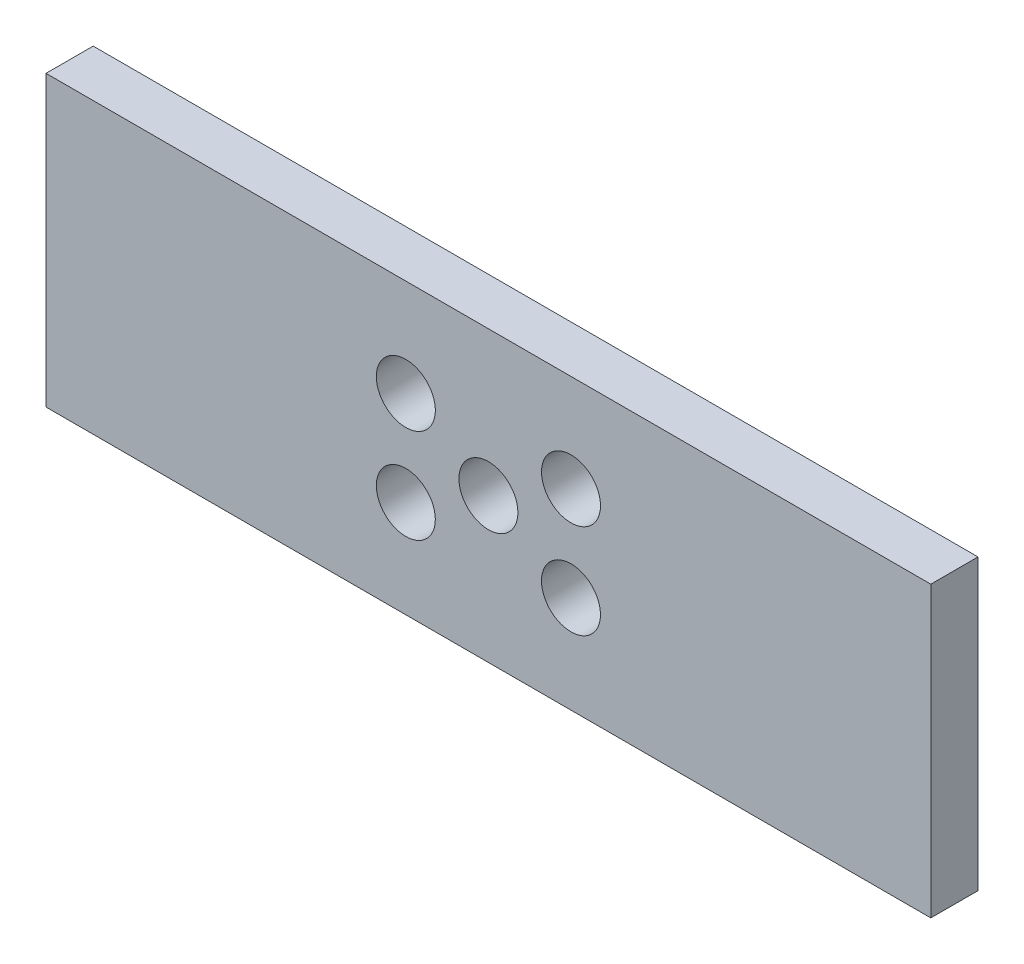
from build123d import *

# Parameters (mm, degrees)
CROQUIS1_W              = 75
CROQUIS1_H              = 24.5
CROQUIS1_R              = 2.5
SALIENTE_EXTRUIR1_DEPTH = 4


with BuildPart() as part:
    # Croquis1 → Saliente-Extruir1 (new body)
    with BuildSketch(Plane.XY):
        Rectangle(CROQUIS1_W, CROQUIS1_H)
        Circle(CROQUIS1_R, mode=Mode.SUBTRACT)
        with Locations((7, 4)):
            Circle(CROQUIS1_R, mode=Mode.SUBTRACT)
        with Locations(Location((7, -4, 0), (0, 0, 180))):
            Circle(CROQUIS1_R, mode=Mode.SUBTRACT)
        with Locations((-7, -4)):
            Circle(CROQUIS1_R, mode=Mode.SUBTRACT)
        with Locations(Location((-7, 4, 0), (0, 0, 180))):
            Circle(CROQUIS1_R, mode=Mode.SUBTRACT)
    extrude(amount=SALIENTE_EXTRUIR1_DEPTH)


solid = part.part
